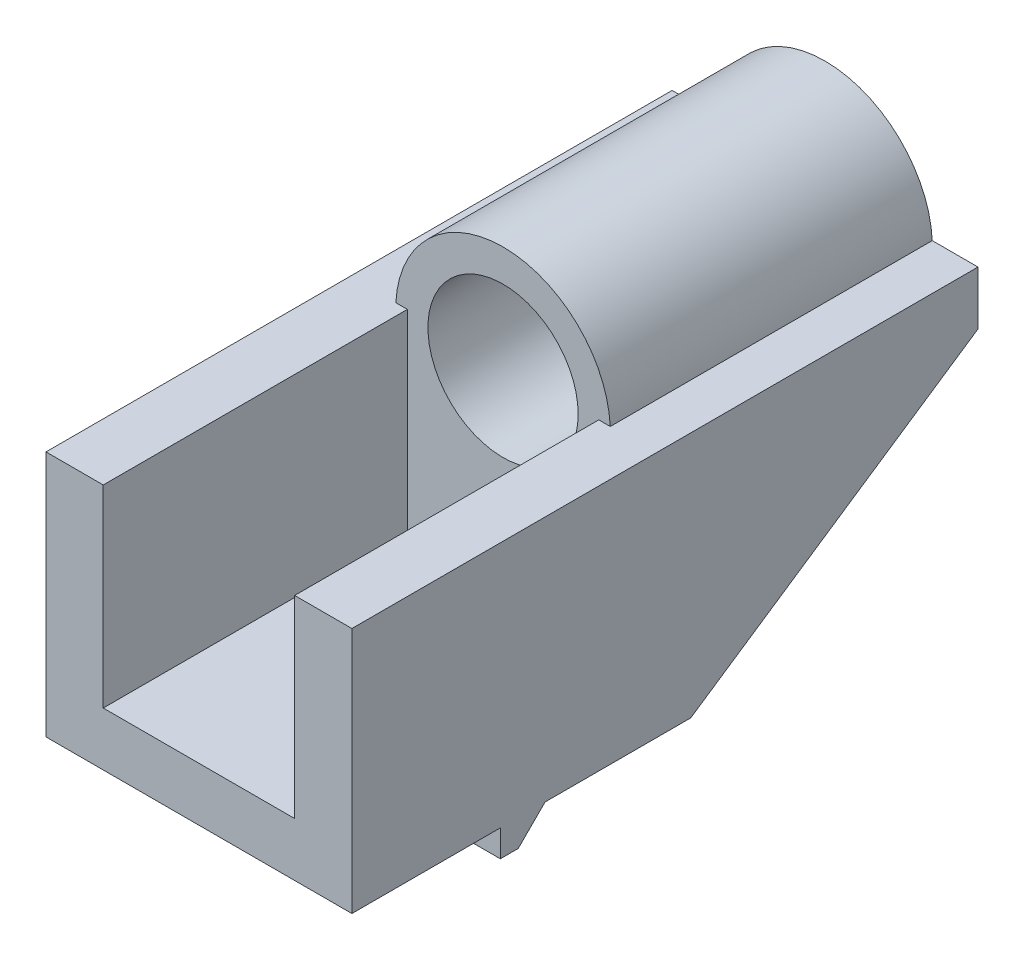
from build123d import *
from build123d.topology import SkipClean

# Parameters (mm, degrees)
BOSS_EXTRUDE1_DEPTH     = 8.55
SKETCH2_W               = 10.7
SKETCH2_H               = 10.8
CUT_EXTRUDE1_DEPTH      = 17
SKETCH3_R               = 6
BOSS_EXTRUDE2_DEPTH     = 18
SKETCH4_R               = 4.2
CUT_EXTRUDE2_DEPTH      = 25.239275979
BOSS_EXTRUDE5_DEPTH     = 17.1
SKETCH7_R               = 2.2
CUT_EXTRUDE3_DEPTH      = 40.626944786
CUT_EXTRUDE4_REACH      = 33.94
SKETCH10_W              = 8.106
SKETCH10_H              = 1.5
SKETCH11_W              = 6.997
SKETCH11_H              = 1
CUT_EXTRUDE5_DEPTH      = 27.591587091
CUT_EXTRUDE6_REACH      = 42.967
CUT_EXTRUDE6_END_RADIUS = 6
CUT_EXTRUDE7_START      = -16.8
CUT_EXTRUDE7_DEPTH      = 16.8
BOSS_EXTRUDE6_DEPTH     = 1.553
BOSS_EXTRUDE7_REACH     = 36.128
CUT_EXTRUDE8_REACH      = 43.851
CUT_EXTRUDE9_REACH      = 43.851


with BuildPart() as part:
    # Sketch1 → Boss-Extrude1 (new, symmetric)
    with BuildSketch(Plane(origin=(0, 0, 0), x_dir=(0, 0, -1), z_dir=(1, 0, 0))):
        Polygon((0, 0), (0, -3), (-16.0587, -13.8), (-35, -13.8), (-35, 0), align=None)
    extrude(amount=BOSS_EXTRUDE1_DEPTH, both=True)

    # Sketch2 → Cut-Extrude1 (cut)
    with BuildSketch(Plane.XY.offset(35)):
        with Locations((0, -5.4)):
            Rectangle(SKETCH2_W, SKETCH2_H)
    extrude(amount=-CUT_EXTRUDE1_DEPTH, mode=Mode.SUBTRACT)

    # Sketch3 → Boss-Extrude2 (add, through all)
    with BuildSketch(Plane.XY.offset(18)):
        with Locations((0, -0.30175)):
            Circle(SKETCH3_R)
    extrude(amount=-BOSS_EXTRUDE2_DEPTH)

    # Sketch4 → Cut-Extrude2 (cut, through all)
    with BuildSketch(Plane.XY.offset(18)):
        with Locations((0, -0.30175)):
            Circle(SKETCH4_R)
    extrude(amount=-CUT_EXTRUDE2_DEPTH, mode=Mode.SUBTRACT)

    # Sketch8 → Boss-Extrude5 (add, through all)
    with BuildSketch(Plane(origin=(8.55, 0, 0), x_dir=(0, 0, -1), z_dir=(1, 0, 0))):
        Polygon((-26.702, -13.8), (-26.702, -15.3), (-25.702, -15.3), (-24.202, -13.8), align=None)
        Polygon((-16.0587, -13.8), (-15.002, -13.8), (-15.002, -14.8), (-14.002, -14.8), (-13, -13.8), (-11.045997115, -10.428793666), align=None)
    extrude(amount=-BOSS_EXTRUDE5_DEPTH)

    # Sketch7 → Cut-Extrude3 (cut, through all)
    with BuildSketch(Plane(origin=(0, -10.8, 0), x_dir=(1, 0, 0), z_dir=(0, 1, 0))):
        with Locations(Location((0, -25, 0), (0, 0, 180))):
            Circle(SKETCH7_R)
    extrude(amount=-CUT_EXTRUDE3_DEPTH, mode=Mode.SUBTRACT)

    # Cut-Extrude4: up to this plane
    cut_extrude4_end = Plane(origin=(-8.55, -15.3, 25.702), z_dir=(0, -0.7071067811865471, -0.707106781186548))
    # Sketch10 → Cut-Extrude4 (cut, up to the surface)
    with BuildSketch(Plane.XY.offset(26.702), mode=Mode.PRIVATE) as cut_extrude4_sk1:
        with Locations((0, -14.55)):
            Rectangle(SKETCH10_W, SKETCH10_H)
    cut_extrude4_tool1 = split(extrude(cut_extrude4_sk1.sketch, amount=-CUT_EXTRUDE4_REACH, mode=Mode.PRIVATE), bisect_by=cut_extrude4_end, keep=Keep.BOTH, mode=Mode.PRIVATE)
    add(cut_extrude4_tool1.solids().sort_by_distance((0, -14.55, 26.702))[0], mode=Mode.SUBTRACT)

    # Sketch11 → Cut-Extrude5 (cut, through all)
    with BuildSketch(Plane.XY.offset(15.002)):
        with Locations((-5.0515, -14.3)):
            Rectangle(SKETCH11_W, SKETCH11_H)
        with Locations((5.0515, -14.3)):
            Rectangle(SKETCH11_W, SKETCH11_H)
    extrude(amount=-CUT_EXTRUDE5_DEPTH, mode=Mode.SUBTRACT)

    # Cut-Extrude6: up to this cylinder (the profile starts outside it)
    cut_extrude6_end = Plane(origin=(0, -0.30175, 7.230062), z_dir=(0, 0, 1)) * Cylinder(CUT_EXTRUDE6_END_RADIUS, 98.934, mode=Mode.PRIVATE)
    # Sketch12 → Cut-Extrude6 (cut, up to the surface)
    with BuildSketch(Plane.XZ.offset(13.8), mode=Mode.PRIVATE) as cut_extrude6_sk1:
        Polygon((-1.553, 13), (-5.353, 16.8), (-5.353, 0), (5.353, 0), (5.353, 16.8), (1.553, 13), align=None)
    cut_extrude6_tool1 = extrude(cut_extrude6_sk1.sketch, amount=-CUT_EXTRUDE6_REACH, mode=Mode.PRIVATE) - cut_extrude6_end
    add(cut_extrude6_tool1.solids().sort_by_distance((0, -13.8, 7.230062))[0], mode=Mode.SUBTRACT)

    # Sketch13 → Cut-Extrude7 (cut)
    with SkipClean():  # the faces are left unmerged after this step: merging them gives an invalid solid
        with BuildSketch(Plane(origin=(0, 0, 0), x_dir=(-1, 0, 0), z_dir=(0, 0, -1)).offset(CUT_EXTRUDE7_START)):
            with BuildLine():
                Line((-5.359052802, -3), (-5.353, -10.428793666))
                Line((-5.353, -10.428793666), (5.353, -10.428793666))
                Line((5.353, -10.428793666), (5.359052802, -3))
                ThreePointArc((5.359052802, -3), (0, -6.30175), (-5.359052802, -3))
            make_face()
        extrude(amount=CUT_EXTRUDE7_DEPTH, mode=Mode.SUBTRACT)

    # Sketch14 → Boss-Extrude6 (add, symmetric)
    with SkipClean():  # the faces are left unmerged after this step: merging them gives an invalid solid
        with BuildSketch(Plane(origin=(0, 0, 0), x_dir=(0, 0, -1), z_dir=(1, 0, 0))):
            Polygon((-13, -13.8), (-8.073269662, -5.3), (-16.8, -5.3), (-16.8, -13.8), align=None)
        extrude(amount=BOSS_EXTRUDE6_DEPTH, both=True)

    # Sketch15 → Boss-Extrude7 (add, up to next)
    with BuildSketch(Plane(origin=(-7.436377386, -6.523873454, 7.436377386), x_dir=(-0.7993387140757535, 0.3962687040508023, -0.4516953999872244), z_dir=(0.6008807037838052, 0.5271477588310114, -0.6008807037838052)), mode=Mode.PRIVATE) as boss_extrude7_sk1:
        Polygon((-11.246017774, 0.733681451), (-11.246017774, 6.495798547), (-15.999947407, 3.239704803), align=None)
    boss_extrude7_tool1 = extrude(boss_extrude7_sk1.sketch, amount=-BOSS_EXTRUDE7_REACH, mode=Mode.PRIVATE) - part.part
    boss_extrude7 = boss_extrude7_tool1.solids().sort_by_distance((2.819667, -8.984956, 15.533333))[0]
    add(boss_extrude7)

    # Mirror1: Boss-Extrude7 across plane
    with SkipClean():  # the faces are left unmerged after this step: merging them gives an invalid solid
        add(boss_extrude7.mirror(Plane(origin=(0, 0, 0), x_dir=(0, 0, 1), z_dir=(1, 0, 0))))

    # Sketch16 → Cut-Extrude8 (cut, up to next)
    with BuildSketch(Plane(origin=(8.55, 0, 0), x_dir=(0, 0, -1), z_dir=(1, 0, 0)), mode=Mode.PRIVATE) as cut_extrude8_sk1:
        Polygon((-11.045997115, -10.428793666), (-16.0587, -13.8), (-13, -13.8), align=None)
    cut_extrude8_tool1 = extrude(cut_extrude8_sk1.sketch, amount=-CUT_EXTRUDE8_REACH, mode=Mode.PRIVATE) & part.part
    add(cut_extrude8_tool1.solids().sort_by_distance((8.55, -12.676265, 13.368232))[0], mode=Mode.SUBTRACT)

    # Sketch17 → Cut-Extrude9 (cut, up to next)
    with BuildSketch(Plane.ZY.offset(8.55), mode=Mode.PRIVATE) as cut_extrude9_sk1:
        Polygon((11.045997115, -10.428793666), (16.0587, -13.8), (13, -13.8), align=None)
    cut_extrude9_tool1 = extrude(cut_extrude9_sk1.sketch, amount=-CUT_EXTRUDE9_REACH, mode=Mode.PRIVATE) & part.part
    add(cut_extrude9_tool1.solids().sort_by_distance((-8.55, -12.676265, 13.368232))[0], mode=Mode.SUBTRACT)


solid = part.part
